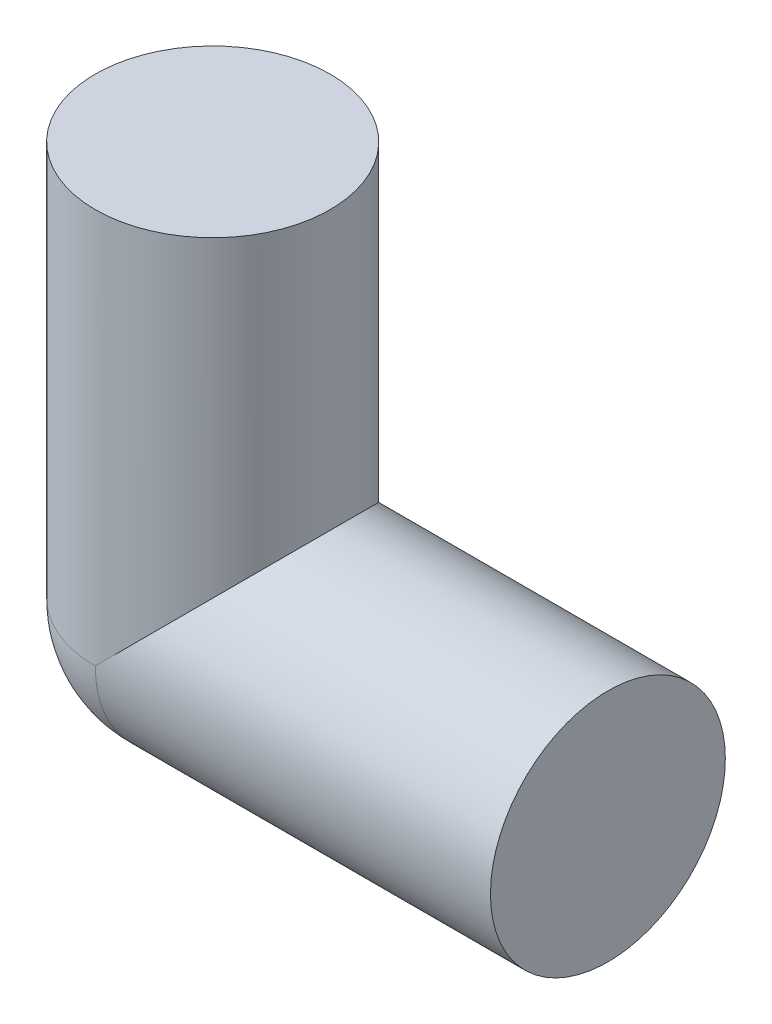
from build123d import *

# Parameters (mm, degrees)
SKETCH1_R           = 8
BOSS_EXTRUDE1_DEPTH = 26.924
SKETCH2_R           = 8
BOSS_EXTRUDE2_DEPTH = 26.924
REVOLVE1_ANGLE      = 90


with BuildPart() as part:
    # Sketch1 → Boss-Extrude1 (new body)
    with BuildSketch(Plane(origin=(0, 0, 0), x_dir=(1, 0, 0), z_dir=(0, 1, 0))):
        with Locations(Location((0, 0, 0), (0, 0, 270))):
            Circle(SKETCH1_R)
    extrude(amount=BOSS_EXTRUDE1_DEPTH)

    # Sketch2 → Boss-Extrude2 (add)
    with BuildSketch(Plane(origin=(0, 0, 0), x_dir=(0, 0, -1), z_dir=(1, 0, 0))):
        Circle(SKETCH2_R)
    extrude(amount=BOSS_EXTRUDE2_DEPTH)

    # Sketch3 → Revolve1 (revolve)
    with BuildSketch(Plane.ZY):
        with BuildLine():
            Line((-8, 0), (8, 0))
            ThreePointArc((8, 0), (0, -8), (-8, 0))
        make_face()
    revolve(axis=Axis((0, 0, 0), (0, 0, -1)), revolution_arc=REVOLVE1_ANGLE)


solid = part.part
